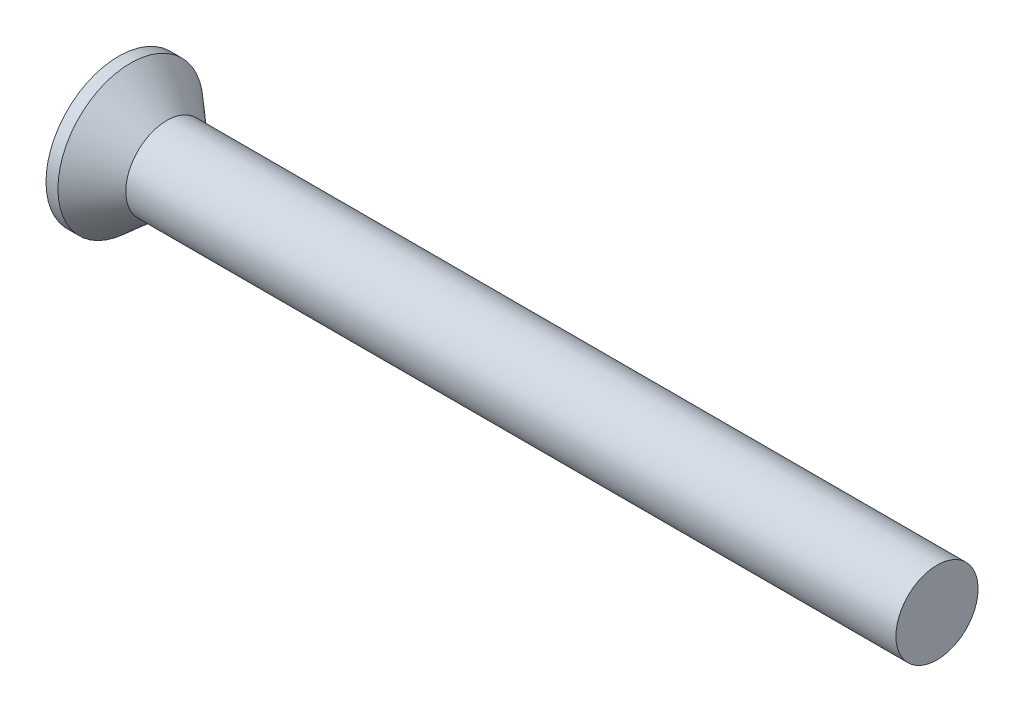
from build123d import *

# Parameters (mm, degrees)
CIRPATTERN1_COUNT = 2
CIRPATTERN1_ANGLE = 90


with BuildPart() as part:
    # BodySke → Base-Revolve (revolve)
    with BuildSketch(Plane.XY, mode=Mode.PRIVATE) as base_revolve_sk:
        Polygon((0, 0), (0, 3.0988), (0.50877405, 3.0988), (2.0574, 1.7526), (34.925, 1.7526), (34.925, 0), align=None)
    revolve(base_revolve_sk.sketch.rotate(Axis((-6.35, 0, 0), (1, 0, 0)), 90), axis=Axis((-6.35, 0, 0), (1, 0, 0)))

    # Sketch3 → Cross section 0
    with BuildSketch(Plane.ZY):
        with BuildLine():
            Line((-0.4826, 2.4765), (0.4826, 2.4765))
            Line((0.4826, 2.4765), (0.4826, -2.4765))
            Line((0.4826, -2.4765), (-0.4826, -2.4765))
            Line((-0.4826, -2.4765), (-0.4826, 2.4765))
        make_face()
    # Sketch4 → Cross section 1
    with BuildSketch(Plane.ZY.offset(-2.8702)):
        with BuildLine():
            Line((-0.2413, 0.2413), (0.2413, 0.2413))
            Line((0.2413, 0.2413), (0.2413, -0.2413))
            Line((0.2413, -0.2413), (-0.2413, -0.2413))
            Line((-0.2413, -0.2413), (-0.2413, 0.2413))
        make_face()
    cross = loft(mode=Mode.SUBTRACT)

    # CirPattern1: Cross ×2 about axis
    cirpattern1_axis = Axis((0, 0, 0), (1, 0, 0))
    for i in range(1, CIRPATTERN1_COUNT):
        add(cross.rotate(cirpattern1_axis, i * CIRPATTERN1_ANGLE / (CIRPATTERN1_COUNT - 1)), mode=Mode.SUBTRACT)


solid = part.part
